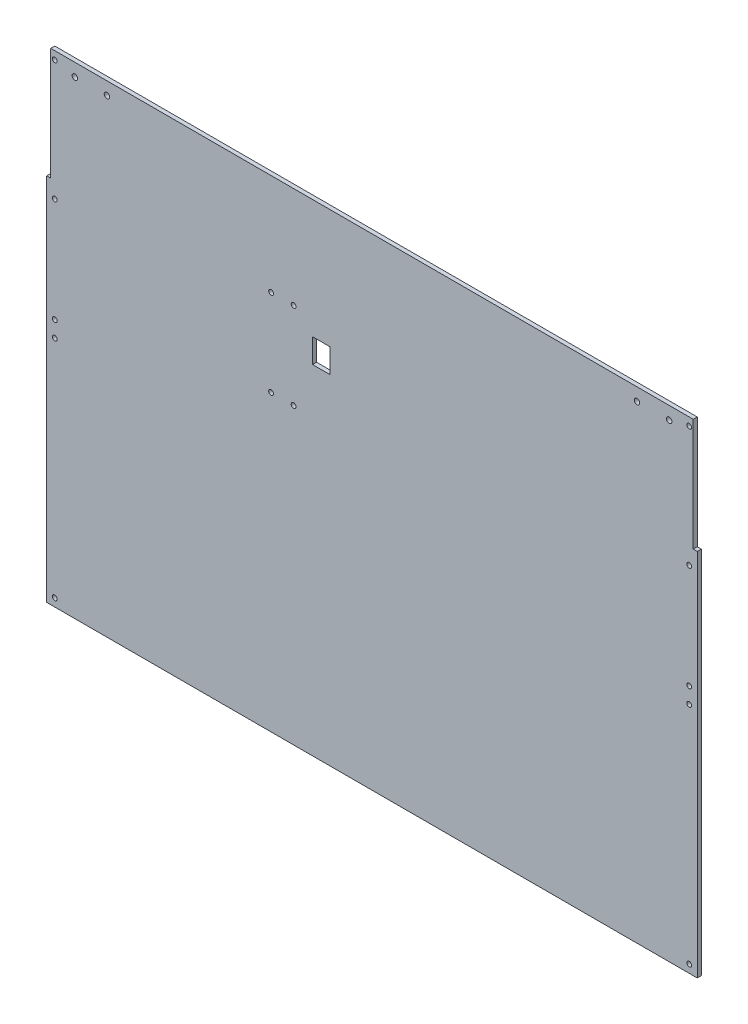
from build123d import *

# Parameters (mm, degrees)
SKETCH1_W           = 508
SKETCH1_H           = 381
BOSS_EXTRUDE1_DEPTH = 3.175
SKETCH3_W           = 13.97
SKETCH3_H           = 19.05
CUT_EXTRUDE2_DEPTH  = 3.175
SKETCH2_R           = 1.905
CUT_EXTRUDE1_DEPTH  = 3.175
SKETCH4_W           = 3.175
SKETCH4_H           = 292.1
BOSS_EXTRUDE2_DEPTH = 3.175
SKETCH5_R           = 2.159
CUT_EXTRUDE3_DEPTH  = 321.061417934


with BuildPart() as part:
    # Sketch1 → Boss-Extrude1 (new body)
    with BuildSketch(Plane.XY):
        Rectangle(SKETCH1_W, SKETCH1_H)
    extrude(amount=BOSS_EXTRUDE1_DEPTH)

    # Sketch3 → Cut-Extrude2 (cut)
    with BuildSketch(Plane.XY.offset(3.175)):
        with Locations((-40.005, 86.995)):
            Rectangle(SKETCH3_W, SKETCH3_H)
    extrude(amount=-CUT_EXTRUDE2_DEPTH, mode=Mode.SUBTRACT)

    # Sketch2 → Cut-Extrude1 (cut)
    with BuildSketch(Plane.XY.offset(3.175)):
        with Locations((250.825, 184.15)):
            Circle(SKETCH2_R)
        with Locations((250.825, -184.15)):
            Circle(SKETCH2_R)
        with Locations((-79.774669, 110.49)):
            Circle(SKETCH2_R)
        with Locations((-79.774669, 41.91)):
            Circle(SKETCH2_R)
        with Locations((-61.994669, 110.49)):
            Circle(SKETCH2_R)
        with Locations((-61.994669, 41.91)):
            Circle(SKETCH2_R)
        with Locations(Location((-250.825, 184.15, 0), (0, 0, 180))):
            Circle(SKETCH2_R)
        with Locations(Location((-250.825, 88.9, 0), (0, 0, 180))):
            Circle(SKETCH2_R)
        with Locations((250.825, 88.9)):
            Circle(SKETCH2_R)
        with Locations((250.825, 6.35)):
            Circle(SKETCH2_R)
        with Locations((250.825, -6.35)):
            Circle(SKETCH2_R)
        with Locations(Location((-250.825, 6.35, 0), (0, 0, 180))):
            Circle(SKETCH2_R)
        with Locations(Location((-250.825, -6.35, 0), (0, 0, 180))):
            Circle(SKETCH2_R)
        with Locations(Location((-250.825, -184.15, 0), (0, 0, 180))):
            Circle(SKETCH2_R)
    extrude(amount=-CUT_EXTRUDE1_DEPTH, mode=Mode.SUBTRACT)

    # Sketch4 → Boss-Extrude2 (add)
    with BuildSketch(Plane.XY.offset(3.175)):
        with Locations((255.5875, -44.45)):
            Rectangle(SKETCH4_W, SKETCH4_H)
        with Locations((-255.5875, -44.45)):
            Rectangle(SKETCH4_W, SKETCH4_H)
    extrude(amount=-BOSS_EXTRUDE2_DEPTH)

    # Sketch5 → Cut-Extrude3 (cut, through all)
    with BuildSketch(Plane(origin=(0, 0, 0), x_dir=(-1, 0, 0), z_dir=(0, 0, -1))):
        with Locations((234.95, 180.34)):
            Circle(SKETCH5_R)
        with Locations((209.55, 180.34)):
            Circle(SKETCH5_R)
        with Locations((-234.95, 180.34)):
            Circle(SKETCH5_R)
        with Locations((-209.55, 180.34)):
            Circle(SKETCH5_R)
    extrude(amount=-CUT_EXTRUDE3_DEPTH, mode=Mode.SUBTRACT)


solid = part.part
